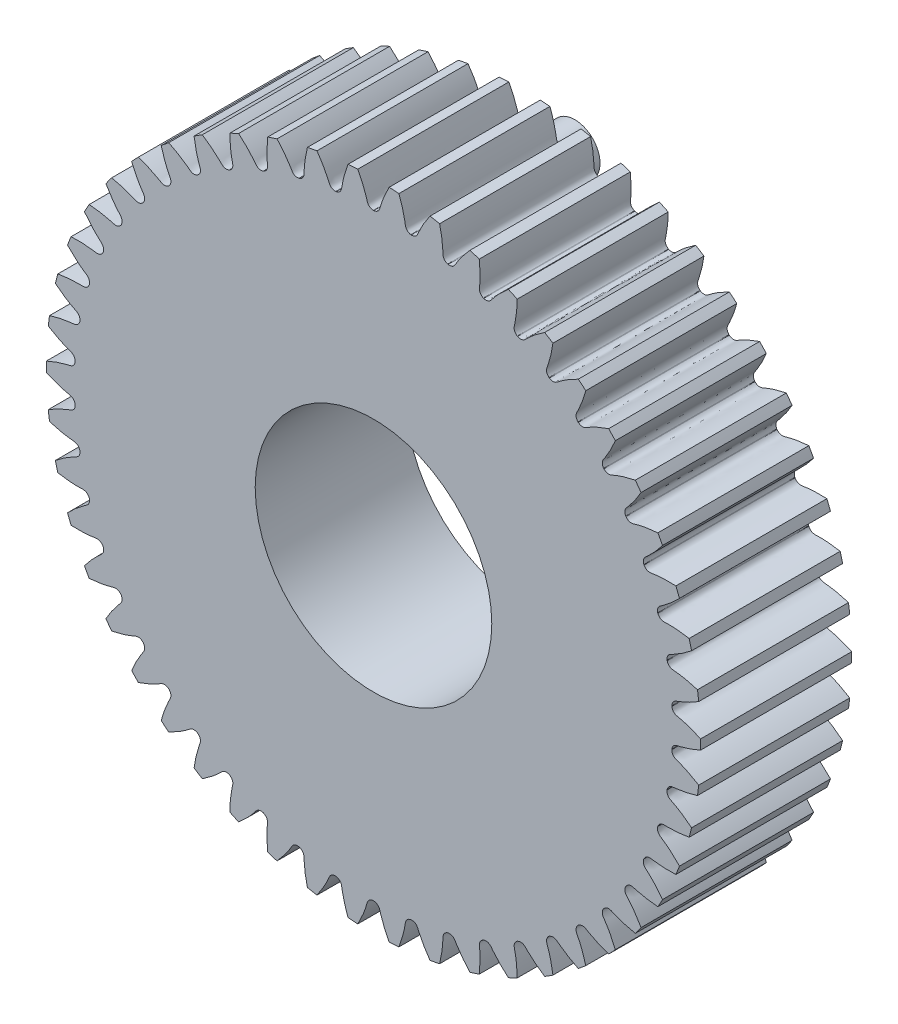
from build123d import *

# Parameters (mm, degrees)
SKETCH_1_R               = 65
EXTRUDE_1_DEPTH          = 30
CUT_EXTRUDE_1_DEPTH      = 97.695398029
PATTERN_CIRCULAR_1_COUNT = 50
SKETCH_7_R               = 5
EXTRUDE_3_DEPTH          = 60
SKETCH_8_R               = 23.5
CUT_EXTRUDE_2_DEPTH      = 110.728316712


with BuildPart() as part:
    # 草图1 → 凸台-拉伸1 (new body)
    with BuildSketch(Plane.XY):
        Circle(SKETCH_1_R)
    extrude(amount=EXTRUDE_1_DEPTH)

    # 草图2 → 切除-拉伸1 (cut, through all)
    with BuildSketch(Plane.XY):
        with BuildLine():
            ThreePointArc((0.045640289, 59.374982459), (0, 59.375), (-0.045640289, 59.374982459))
            add(Edge.make_bspline(
                [(-0.045640289, 59.374982459), (-1.087566924, 59.502323849), (-1.220658064, 60.288855482), (-1.486961448, 61.146898754), (-1.596729657, 61.482351407), (-1.721359878, 61.837474555), (-1.861155252, 62.212117731), (-2.01709746, 62.6057138), (-2.189951835, 63.01778551), (-2.380529257, 63.447797187), (-2.589608791, 63.895198507), (-2.81795933, 64.359412251), (-3.066332492, 64.839838344), (-3.33546384, 65.33585321), (-3.626071724, 65.846810498), (-3.938856812, 66.372041428), (-4.274501442, 66.910855274), (-4.633669038, 67.462539824), (-5.017003519, 68.026361865), (-5.425128734, 68.60156768), (-5.858647895, 69.187383562), (-6.318143034, 69.783016342), (-6.804174453, 70.387653926), (-7.317280266, 71.000465855), (-7.857975647, 71.620603869), (-8.626872743, 72.467665761), (-9.230839639, 73.093691674), (-9.646985178, 73.508572504)],
                knots=[0, 0, 0, 0, 0.116496199, 0.135538346, 0.15593866, 0.177697141, 0.200813789, 0.225288605, 0.251121587, 0.278312737, 0.306862053, 0.336769537, 0.368035188, 0.400659005, 0.43464099, 0.469981142, 0.506679462, 0.544735948, 0.584150601, 0.624923421, 0.667054409, 0.710543564, 0.755390885, 0.801596374, 0.84916003, 0.898081853, 1, 1, 1, 1], degree=3))
            ThreePointArc((-9.646985178, 73.508572504), (0, 74.138886926), (9.646985178, 73.508572504))
            add(Edge.make_bspline(
                [(0.045640289, 59.374982459), (1.087566924, 59.502323849), (1.220658064, 60.288855482), (1.486961448, 61.146898754), (1.596729657, 61.482351407), (1.721359878, 61.837474555), (1.861155252, 62.212117731), (2.01709746, 62.6057138), (2.189951835, 63.01778551), (2.380529257, 63.447797187), (2.589608791, 63.895198507), (2.81795933, 64.359412251), (3.066332492, 64.839838344), (3.33546384, 65.33585321), (3.626071724, 65.846810498), (3.938856812, 66.372041428), (4.274501442, 66.910855274), (4.633669038, 67.462539824), (5.017003519, 68.026361865), (5.425128734, 68.60156768), (5.858647895, 69.187383562), (6.318143034, 69.783016342), (6.804174453, 70.387653926), (7.317280266, 71.000465855), (7.857975647, 71.620603869), (8.626872743, 72.467665761), (9.230839639, 73.093691674), (9.646985178, 73.508572504)],
                knots=[0, 0, 0, 0, 0.116496199, 0.135538346, 0.15593866, 0.177697141, 0.200813789, 0.225288605, 0.251121587, 0.278312737, 0.306862053, 0.336769537, 0.368035188, 0.400659005, 0.43464099, 0.469981142, 0.506679462, 0.544735948, 0.584150601, 0.624923421, 0.667054409, 0.710543564, 0.755390885, 0.801596374, 0.84916003, 0.898081853, 1, 1, 1, 1], degree=3))
        make_face()
    cut_extrude_1 = extrude(amount=CUT_EXTRUDE_1_DEPTH, mode=Mode.SUBTRACT)

    # 阵列(圆周)1: 切除-拉伸1 ×50 about axis
    pattern_circular_1_axis = Axis((0, 0, 30), (0, 0, -1))
    for i in range(1, PATTERN_CIRCULAR_1_COUNT):
        add(cut_extrude_1.rotate(pattern_circular_1_axis, i * 360 / PATTERN_CIRCULAR_1_COUNT), mode=Mode.SUBTRACT)

    # 草图7 → 凸台-拉伸3 (add)
    with BuildSketch(Plane(origin=(0, 0, 0), x_dir=(-1, 0, 0), z_dir=(0, 0, -1))):
        with Locations((50, 0)):
            Circle(SKETCH_7_R)
    extrude(amount=EXTRUDE_3_DEPTH)

    # 草图8 → 切除-拉伸2 (cut, through all)
    with BuildSketch(Plane(origin=(0, 0, 0), x_dir=(-1, 0, 0), z_dir=(0, 0, -1))):
        Circle(SKETCH_8_R)
    extrude(amount=-CUT_EXTRUDE_2_DEPTH, mode=Mode.SUBTRACT)


solid = part.part
